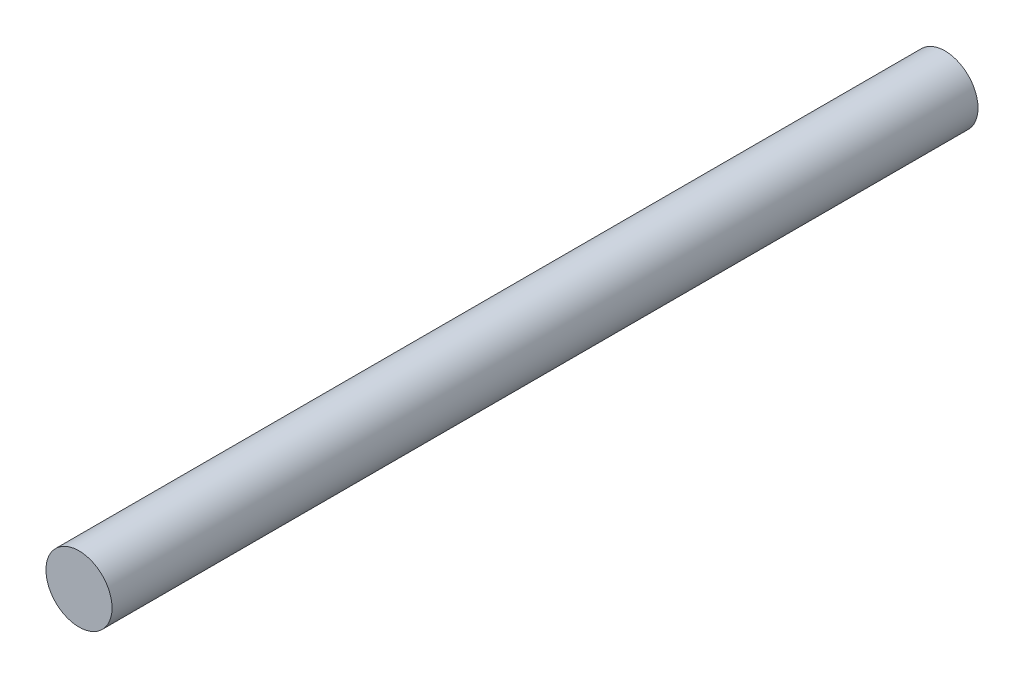
from build123d import *

# Parameters (mm, degrees)
SKICA1_R                = 1
P_IDAT_VYSUNUT_M1_DEPTH = 26.2


with BuildPart() as part:
    # Skica1 → Přidat vysunutím1 (new body)
    with BuildSketch(Plane.XY):
        Circle(SKICA1_R)
    extrude(amount=P_IDAT_VYSUNUT_M1_DEPTH)


solid = part.part
